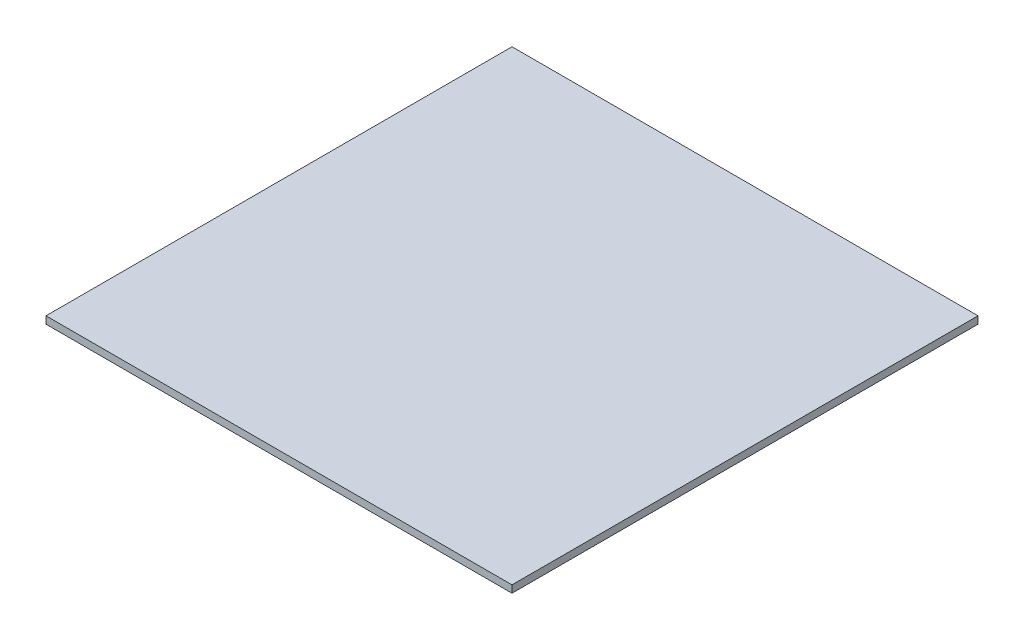
from build123d import *

# Parameters (mm, degrees)
SKETCH2_W           = 203.2
SKETCH2_H           = 203.2
BOSS_EXTRUDE1_DEPTH = 3.175


with BuildPart() as part:
    # Sketch2 → Boss-Extrude1 (new body)
    with BuildSketch(Plane(origin=(0, 0, 0), x_dir=(1, 0, 0), z_dir=(0, 1, 0))):
        Rectangle(SKETCH2_W, SKETCH2_H)
    extrude(amount=BOSS_EXTRUDE1_DEPTH)


solid = part.part
